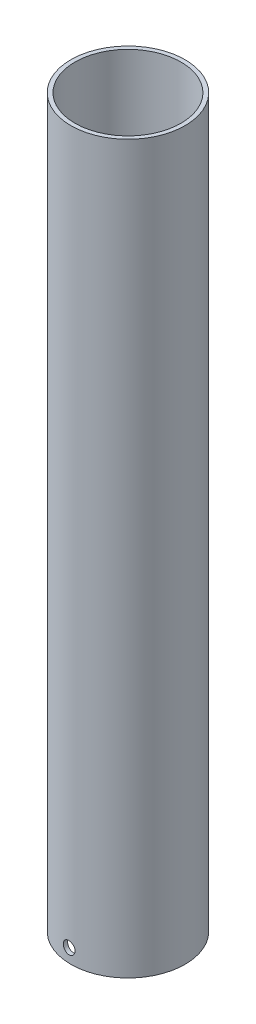
from build123d import *

# Parameters (mm, degrees)
SKETCH_1_R               = 14
SKETCH_1_R_2             = 13
EXTRUDE_1_DEPTH          = 178
CUT_EXTRUDE_1_DEPTH      = 182.353433054
CUT_EXTRUDE_1_DEPTH_BACK = 182.353433054
SKETCH_2_R               = 1.5


with BuildPart() as part:
    # 草图1 → 凸台-拉伸1 (new body)
    with BuildSketch(Plane(origin=(0, 0, 0), x_dir=(1, 0, 0), z_dir=(0, 1, 0))):
        with Locations(Location((0, 0, 0), (0, 0, 270))):
            Circle(SKETCH_1_R)
        with Locations(Location((0, 0, 0), (0, 0, 270))):
            Circle(SKETCH_1_R_2, mode=Mode.SUBTRACT)
    extrude(amount=EXTRUDE_1_DEPTH)

    # 草图2 → 切除-拉伸1 (cut, two sides: drawn at the far end of the back side and taken through both)
    with BuildSketch(Plane(origin=(-0.611311919, 0, 17.489319533), x_dir=(0.9993896876177671, 0, 0.034932109630852956), z_dir=(-0.034932109630852956, 0, 0.9993896876177673)).offset(-CUT_EXTRUDE_1_DEPTH_BACK)):
        with Locations((0, 3.302851194)):
            Circle(SKETCH_2_R)
    extrude(amount=CUT_EXTRUDE_1_DEPTH + CUT_EXTRUDE_1_DEPTH_BACK, mode=Mode.SUBTRACT)


solid = part.part
